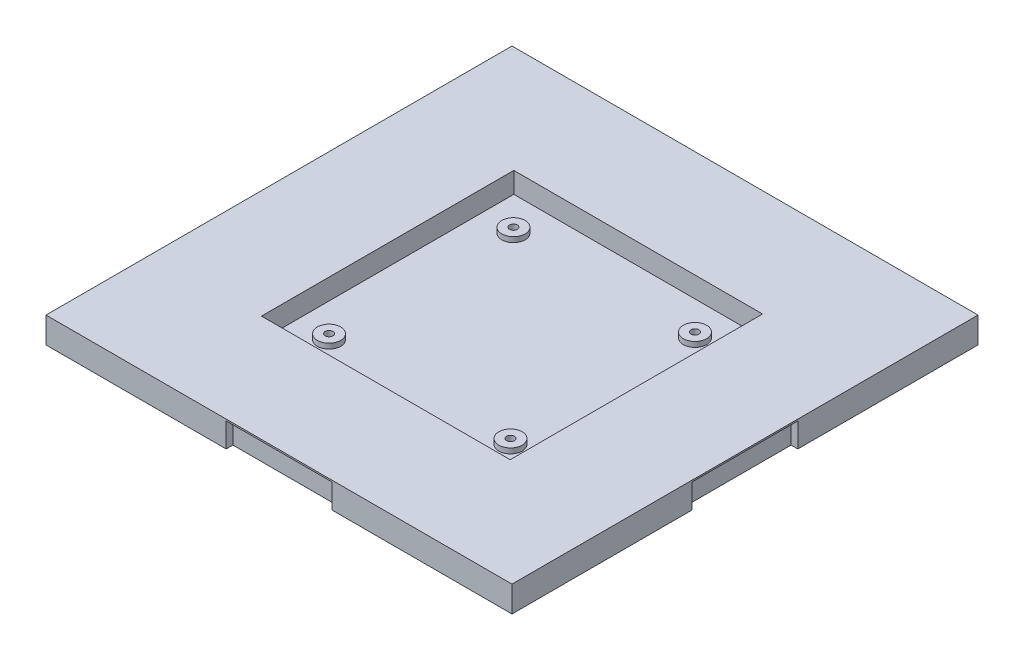
from build123d import *

# Parameters (mm, degrees)
SKETCH1_W           = 180
SKETCH1_H           = 180
SKETCH1_W_2         = 96.073021888
SKETCH1_H_2         = 97.47003078
BOSS_EXTRUDE1_DEPTH = 10
SKETCH1_3_W         = 96.073021888
SKETCH1_3_H         = 97.47003078
SKETCH1_3_R         = 4.5
BOSS_EXTRUDE2_DEPTH = 2
SKETCH1_5_R         = 1.5
BOSS_EXTRUDE3_DEPTH = 4
CUT_EXTRUDE1_START  = 4
SKETCH1_6_R         = 1.5
CUT_EXTRUDE1_DEPTH  = 2.5
SKETCH4_W           = 40
SKETCH4_H           = 9
CUT_EXTRUDE3_DEPTH  = 2.6
CIRPATTERN2_COUNT   = 4


with BuildPart() as part:
    # Sketch1 → Boss-Extrude1 (new body)
    with BuildSketch(Plane(origin=(0, 0, 0), x_dir=(1, 0, 0), z_dir=(0, 1, 0))):
        Rectangle(SKETCH1_W, SKETCH1_H)
        Rectangle(SKETCH1_W_2, SKETCH1_H_2, mode=Mode.SUBTRACT)
    extrude(amount=BOSS_EXTRUDE1_DEPTH)

    # Sketch1<3> → Boss-Extrude2 (add)
    with BuildSketch(Plane(origin=(0, 0, 0), x_dir=(1, 0, 0), z_dir=(0, 1, 0))):
        Rectangle(SKETCH1_3_W, SKETCH1_3_H)
        with Locations(Location((34.990916942, 35.687000466, 0), (0, 0, 270))):
            Circle(SKETCH1_3_R, mode=Mode.SUBTRACT)
        with Locations(Location((34.990916942, -35.558880992, 0), (0, 0, 270))):
            Circle(SKETCH1_3_R, mode=Mode.SUBTRACT)
        with Locations(Location((-35.115505573, -35.558880992, 0), (0, 0, 270))):
            Circle(SKETCH1_3_R, mode=Mode.SUBTRACT)
        with Locations(Location((-35.115505573, 35.687000466, 0), (0, 0, 270))):
            Circle(SKETCH1_3_R, mode=Mode.SUBTRACT)
    extrude(amount=BOSS_EXTRUDE2_DEPTH)

    # Sketch1<5> → Boss-Extrude3 (add)
    # profile 1 of 12: a face of its own
    with BuildSketch(Plane(origin=(0, 0, 0), x_dir=(1, 0, 0), z_dir=(0, 1, 0))):
        with BuildLine():
            Line((-38.036510944, -38.73501539), (-38.036510944, -32.135764339))
            ThreePointArc((-38.036510944, -32.135764339), (-38.417826814, -38.615787014), (-31.927689662, -38.73501539))
            Line((-31.927689662, -38.73501539), (-38.036510944, -38.73501539))
        make_face()
    # profile 2 of 12: a face of its own
    with BuildSketch(Plane(origin=(0, 0, 0), x_dir=(1, 0, 0), z_dir=(0, 1, 0))):
        with BuildLine():
            ThreePointArc((-30.615505573, -35.558880992), (-33.230634778, -31.472652647), (-38.036510944, -32.135764339))
            Line((-38.036510944, -32.135764339), (-38.036510944, -38.73501539))
            Line((-38.036510944, -38.73501539), (-31.927689662, -38.73501539))
            ThreePointArc((-31.927689662, -38.73501539), (-30.95646893, -37.277140053), (-30.615505573, -35.558880992))
        make_face()
        with Locations((-35.115505573, -35.558880992)):
            Circle(SKETCH1_5_R, mode=Mode.SUBTRACT)
    # profile 3 of 12: a face of its own
    with BuildSketch(Plane(origin=(0, 0, 0), x_dir=(1, 0, 0), z_dir=(0, 1, 0))):
        with Locations((-35.115505573, -35.558880992)):
            Circle(SKETCH1_5_R)
    # profile 4 of 12: a face of its own
    with BuildSketch(Plane(origin=(0, 0, 0), x_dir=(1, 0, 0), z_dir=(0, 1, 0))):
        with BuildLine():
            Line((38.036510944, -38.73501539), (38.036510944, -32.246124259))
            ThreePointArc((38.036510944, -32.246124259), (31.745692174, -32.441427511), (31.80310103, -38.73501539))
            Line((31.80310103, -38.73501539), (38.036510944, -38.73501539))
        make_face()
        with Locations((34.990916942, -35.558880992)):
            Circle(SKETCH1_5_R, mode=Mode.SUBTRACT)
    # profile 5 of 12: a face of its own
    with BuildSketch(Plane(origin=(0, 0, 0), x_dir=(1, 0, 0), z_dir=(0, 1, 0))):
        with Locations((34.990916942, -35.558880992)):
            Circle(SKETCH1_5_R)
    # profile 6 of 12: a face of its own
    with BuildSketch(Plane(origin=(0, 0, 0), x_dir=(1, 0, 0), z_dir=(0, 1, 0))):
        with BuildLine():
            ThreePointArc((39.490916942, -35.558880992), (39.111303636, -33.74989965), (38.036510944, -32.246124259))
            Line((38.036510944, -32.246124259), (38.036510944, -38.73501539))
            Line((38.036510944, -38.73501539), (31.80310103, -38.73501539))
            ThreePointArc((31.80310103, -38.73501539), (36.709176002, -39.717917636), (39.490916942, -35.558880992))
        make_face()
    # profile 7 of 12: a face of its own
    with BuildSketch(Plane(origin=(0, 0, 0), x_dir=(1, 0, 0), z_dir=(0, 1, 0))):
        with BuildLine():
            Line((-31.804976156, 38.73501539), (-38.036510944, 38.73501539))
            Line((-38.036510944, 38.73501539), (-38.036510944, 32.263883812))
            ThreePointArc((-38.036510944, 32.263883812), (-33.230634778, 31.600772121), (-30.615505573, 35.687000466))
            ThreePointArc((-30.615505573, 35.687000466), (-30.923406912, 37.322943255), (-31.804976156, 38.73501539))
        make_face()
        with Locations((-35.115505573, 35.687000466)):
            Circle(SKETCH1_5_R, mode=Mode.SUBTRACT)
    # profile 8 of 12: a face of its own
    with BuildSketch(Plane(origin=(0, 0, 0), x_dir=(1, 0, 0), z_dir=(0, 1, 0))):
        with Locations((-35.115505573, 35.687000466)):
            Circle(SKETCH1_5_R)
    # profile 9 of 12: a face of its own
    with BuildSketch(Plane(origin=(0, 0, 0), x_dir=(1, 0, 0), z_dir=(0, 1, 0))):
        with BuildLine():
            Line((-38.036510944, 32.263883812), (-38.036510944, 38.73501539))
            Line((-38.036510944, 38.73501539), (-31.804976156, 38.73501539))
            ThreePointArc((-31.804976156, 38.73501539), (-38.356927826, 38.808407485), (-38.036510944, 32.263883812))
        make_face()
    # profile 10 of 12: a face of its own
    with BuildSketch(Plane(origin=(0, 0, 0), x_dir=(1, 0, 0), z_dir=(0, 1, 0))):
        with BuildLine():
            Line((38.036510944, 38.73501539), (31.680387525, 38.73501539))
            ThreePointArc((31.680387525, 38.73501539), (31.807773572, 32.50618323), (38.036510944, 32.374243733))
            Line((38.036510944, 32.374243733), (38.036510944, 38.73501539))
        make_face()
        with Locations((34.990916942, 35.687000466)):
            Circle(SKETCH1_5_R, mode=Mode.SUBTRACT)
    # profile 11 of 12: a face of its own
    with BuildSketch(Plane(origin=(0, 0, 0), x_dir=(1, 0, 0), z_dir=(0, 1, 0))):
        with Locations((34.990916942, 35.687000466)):
            Circle(SKETCH1_5_R)
    # profile 12 of 12: a face of its own
    with BuildSketch(Plane(origin=(0, 0, 0), x_dir=(1, 0, 0), z_dir=(0, 1, 0))):
        with BuildLine():
            ThreePointArc((39.490916942, 35.687000466), (36.626859732, 39.879099127), (31.680387525, 38.73501539))
            Line((31.680387525, 38.73501539), (38.036510944, 38.73501539))
            Line((38.036510944, 38.73501539), (38.036510944, 32.374243733))
            ThreePointArc((38.036510944, 32.374243733), (39.111303636, 33.878019124), (39.490916942, 35.687000466))
        make_face()
    extrude(amount=BOSS_EXTRUDE3_DEPTH)

    # Sketch1<6> → Cut-Extrude1 (cut)
    with BuildSketch(Plane(origin=(0, 0, 0), x_dir=(1, 0, 0), z_dir=(0, 1, 0)).offset(CUT_EXTRUDE1_START)):
        with Locations(Location((-35.115505573, 35.687000466, 0), (0, 0, 270))):
            Circle(SKETCH1_6_R)
        with Locations(Location((34.990916942, 35.687000466, 0), (0, 0, 270))):
            Circle(SKETCH1_6_R)
        with Locations(Location((34.990916942, -35.558880992, 0), (0, 0, 270))):
            Circle(SKETCH1_6_R)
        with Locations(Location((-35.115505573, -35.558880992, 0), (0, 0, 270))):
            Circle(SKETCH1_6_R)
    extrude(amount=-CUT_EXTRUDE1_DEPTH, mode=Mode.SUBTRACT)

    # Sketch4 → Cut-Extrude3 (cut)
    with BuildSketch(Plane(origin=(0, 0, -90), x_dir=(-1, 0, 0), z_dir=(0, 0, -1))):
        Polygon((-20, 0), (-20, 9), (20, 9), (20, 0), (20.4, 0), (20.4, 9.4), (-20.4, 9.4), (-20.4, 0), align=None)
        with Locations((0, 4.5)):
            Rectangle(SKETCH4_W, SKETCH4_H)
    cut_extrude3 = extrude(amount=-CUT_EXTRUDE3_DEPTH, mode=Mode.SUBTRACT)

    # CirPattern2: Cut-Extrude3 ×4 about axis
    cirpattern2_axis = Axis((0.001740107, 0, 0.001789421), (0, 1, 0))
    for i in range(1, CIRPATTERN2_COUNT):
        add(cut_extrude3.rotate(cirpattern2_axis, i * 360 / CIRPATTERN2_COUNT), mode=Mode.SUBTRACT)


solid = part.part
